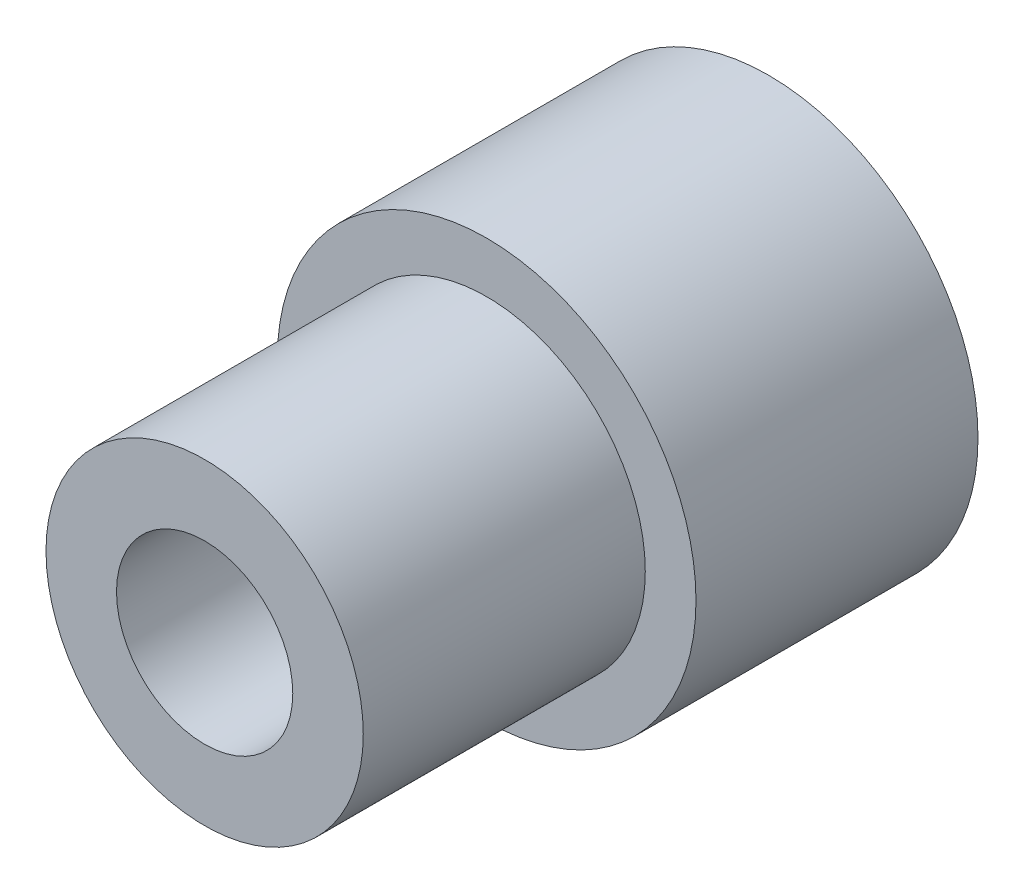
from build123d import *

# Parameters (mm, degrees)
SKETCH1_R           = 3.77063
SKETCH1_R_2         = 2.50063
BOSS_EXTRUDE1_DEPTH = 5.08
SKETCH2_R           = 2.8575
SKETCH2_R_2         = 1.5875
BOSS_EXTRUDE2_DEPTH = 5.08


with BuildPart() as part:
    # Sketch1 → Boss-Extrude1 (new body)
    with BuildSketch(Plane.XY):
        Circle(SKETCH1_R)
        Circle(SKETCH1_R_2, mode=Mode.SUBTRACT)
    extrude(amount=BOSS_EXTRUDE1_DEPTH)

    # Sketch2 → Boss-Extrude2 (add)
    with BuildSketch(Plane.XY.offset(5.08)):
        Circle(SKETCH2_R)
        Circle(SKETCH2_R_2, mode=Mode.SUBTRACT)
    extrude(amount=BOSS_EXTRUDE2_DEPTH)


solid = part.part
